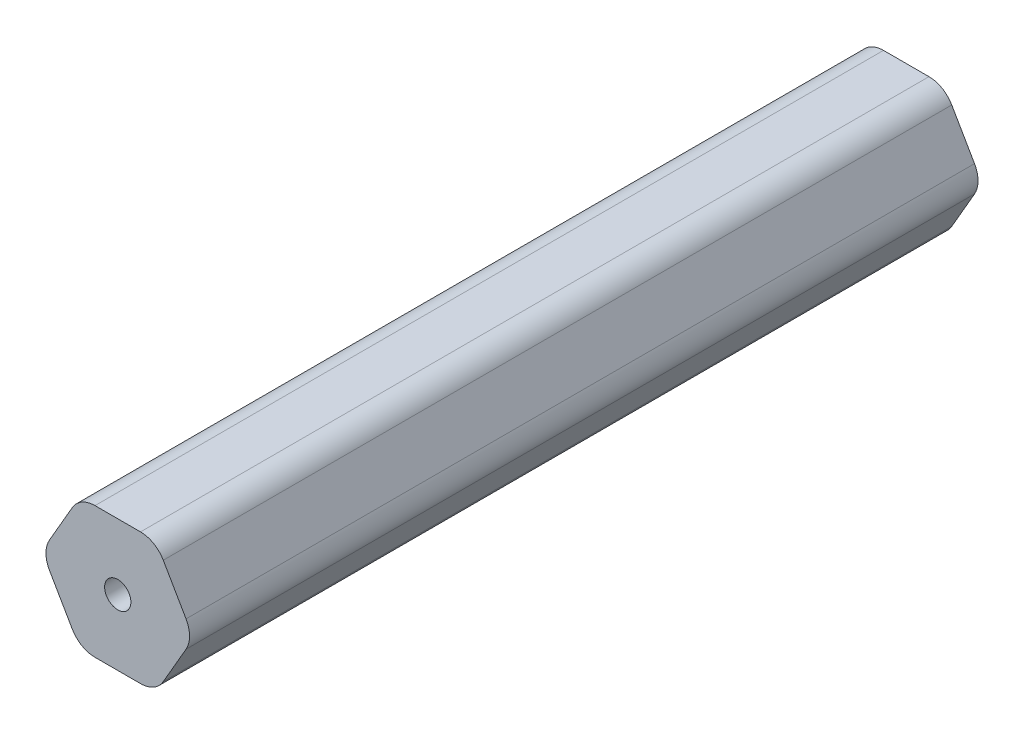
from build123d import *

# Parameters (mm, degrees)
SKETCH1_R           = 1.27
BOSS_EXTRUDE1_DEPTH = 76.2
FILLET1_R           = 2.54


with BuildPart() as part:
    # Sketch1 → Boss-Extrude1 (new body)
    with BuildSketch(Plane.XY):
        Polygon((0.862629226, -0.934514995), (-2.803544984, 5.415485005), (-10.135893402, 5.415485005), (-13.802067612, -0.934514995), (-10.135893402, -7.284514995), (-2.803544984, -7.284514995), align=None)
        with Locations(Location((-6.469719193, -0.934514995, 0), (0, 0, 180))):
            Circle(SKETCH1_R, mode=Mode.SUBTRACT)
    extrude(amount=BOSS_EXTRUDE1_DEPTH)

    # Fillet1
    fillet1_edges = [part.edges().sort_by_distance(p)[0] for p in [
        (-2.803544984, -7.284514995, 38.1),
        (-10.135893402, -7.284514995, 38.1),
        (-13.802067612, -0.934514995, 38.1),
        (-10.135893402, 5.415485005, 38.1),
        (-2.803544984, 5.415485005, 38.1),
        (0.862629226, -0.934514995, 38.1),
    ]]
    fillet(fillet1_edges, radius=FILLET1_R)


solid = part.part
